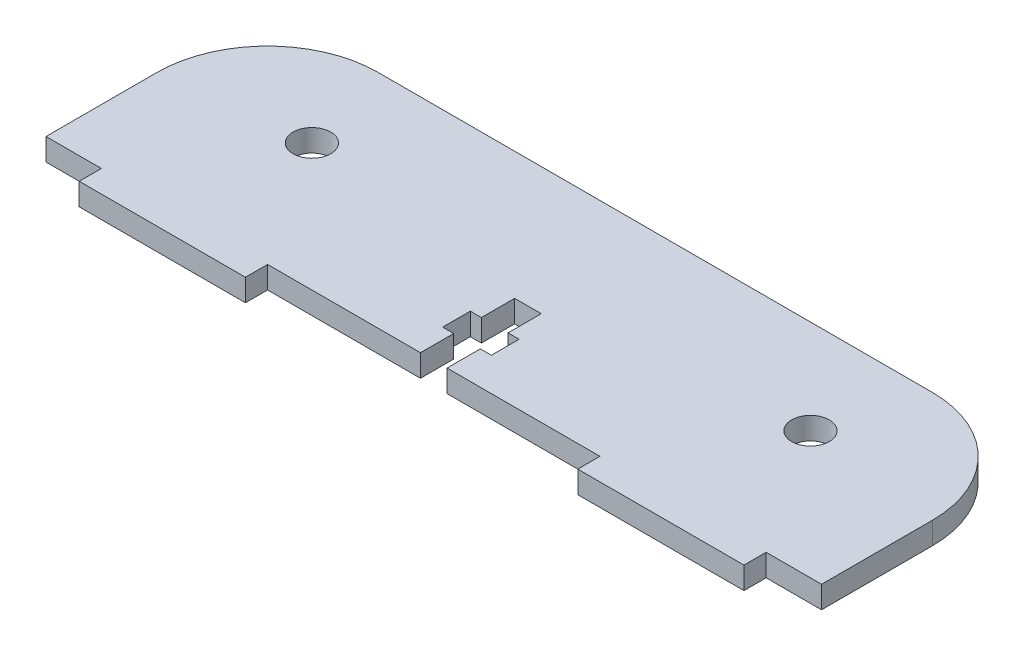
from build123d import *

# Parameters (mm, degrees)
SKETCH_1_W          = 70
SKETCH_1_H          = 20
SKETCH_1_R          = 1.7
EXTRUDE_1_DEPTH     = 2
CUT_EXTRUDE_1_DEPTH = 2
SKETCH_3_W          = 15
SKETCH_3_H          = 2
EXTRUDE_2_DEPTH     = 2
FILLET_1_R          = 10


with BuildPart() as part:
    # 草图1 → 凸台-拉伸1 (new body)
    with BuildSketch(Plane(origin=(0, 0, 0), x_dir=(1, 0, 0), z_dir=(0, 1, 0))):
        with Locations((35, -10)):
            Rectangle(SKETCH_1_W, SKETCH_1_H)
        with Locations(Location((57.5, -8.5, 0), (0, 0, 270))):
            Circle(SKETCH_1_R, mode=Mode.SUBTRACT)
        with Locations(Location((12.5, -8.5, 0), (0, 0, 270))):
            Circle(SKETCH_1_R, mode=Mode.SUBTRACT)
    extrude(amount=EXTRUDE_1_DEPTH)

    # 草图2 → 切除-拉伸1 (cut)
    with BuildSketch(Plane(origin=(0, 2, 0), x_dir=(1, 0, 0), z_dir=(0, 1, 0))):
        Polygon((33.8, -20), (33.8, -17), (32.8, -17), (32.8, -14.5), (33.8, -14.5), (33.8, -11.5), (36.2, -11.5), (36.2, -14.5), (37.2, -14.5), (37.2, -17), (36.2, -17), (36.2, -20), align=None)
    extrude(amount=-CUT_EXTRUDE_1_DEPTH, mode=Mode.SUBTRACT)

    # 草图3 → 凸台-拉伸2 (add)
    with BuildSketch(Plane(origin=(0, 2, 0), x_dir=(1, 0, 0), z_dir=(0, 1, 0))):
        with Locations((12.5, -21)):
            Rectangle(SKETCH_3_W, SKETCH_3_H)
        with Locations((57.5, -21)):
            Rectangle(SKETCH_3_W, SKETCH_3_H)
    extrude(amount=-EXTRUDE_2_DEPTH)

    # 圆角1
    fillet_1_edges = [part.edges().sort_by_distance(p)[0] for p in [
        (0, 1, 0),
        (70, 1, 0),
    ]]
    fillet(fillet_1_edges, radius=FILLET_1_R)


solid = part.part
